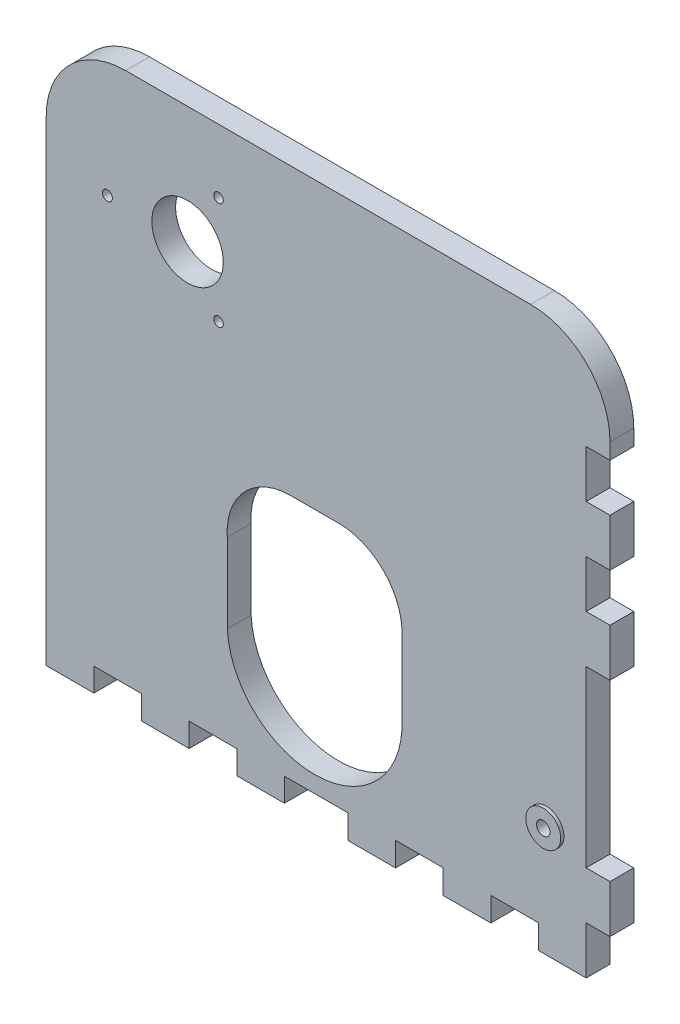
from build123d import *

# Parameters (mm, degrees)
SKETCH1_R           = 11
SKETCH1_R_2         = 3.142556432
SKETCH1_R_3         = 22.5
SKETCH1_R_4         = 3
BOSS_EXTRUDE1_DEPTH = 15
BOSS_EXTRUDE2_START = 10
SKETCH3_R           = 11
SKETCH3_R_2         = 4.25
BOSS_EXTRUDE2_DEPTH = 10


with BuildPart() as part:
    # Sketch1 → Boss-Extrude1 (new body)
    with BuildSketch(Plane.XY):
        with BuildLine():
            Line((-120, 172.705707432), (135, 172.705707432))
            ThreePointArc((135, 172.705707432), (170.355339059, 158.061046491), (185, 122.705707432))
            Line((185, 122.705707432), (185, 112.705707432))
            Line((185, 112.705707432), (170, 112.705707432))
            Line((170, 112.705707432), (170, 82.705707432))
            Line((170, 82.705707432), (185, 82.705707432))
            Line((185, 82.705707432), (185, 52.705707432))
            Line((185, 52.705707432), (170, 52.705707432))
            Line((170, 52.705707432), (170, 22.705707432))
            Line((170, 22.705707432), (185, 22.705707432))
            Line((185, 22.705707432), (185, -7.294292568))
            Line((185, -7.294292568), (170, -7.294292568))
            Line((170, -7.294292568), (170, -117.094321696))
            Line((170, -117.094321696), (185, -117.094321696))
            Line((185, -117.094321696), (185, -147.094321696))
            Line((185, -147.094321696), (170, -147.094321696))
            Line((170, -147.094321696), (170, -162.094292568))
            Line((170, -162.094292568), (170, -177.170123414))
            Line((170, -177.170123414), (140, -177.170123414))
            Line((140, -177.170123414), (140, -162.094292568))
            Line((140, -162.094292568), (110, -162.094292568))
            Line((110, -162.094292568), (110, -177.182197899))
            Line((110, -177.182197899), (80, -177.182197899))
            Line((80, -177.182197899), (80, -162.094292568))
            Line((80, -162.094292568), (50, -162.094292568))
            Line((50, -162.094292568), (50, -177.165057848))
            Line((50, -177.165057848), (20, -177.165057848))
            Line((20, -177.165057848), (20, -162.094292568))
            Line((20, -162.094292568), (-20, -162.094292568))
            Line((-20, -162.094292568), (-20, -176.865618337))
            Line((-20, -176.865618337), (-50, -176.865618337))
            Line((-50, -176.865618337), (-50, -162.094292568))
            Line((-50, -162.094292568), (-80, -162.094292568))
            Line((-80, -162.094292568), (-80, -177.034188853))
            Line((-80, -177.034188853), (-110, -177.034188853))
            Line((-110, -177.034188853), (-110, -162.094292568))
            Line((-110, -162.094292568), (-140, -162.094292568))
            Line((-140, -162.094292568), (-140, -176.801614054))
            Line((-140, -176.801614054), (-170, -176.801614054))
            Line((-170, -176.801614054), (-170, -167.294292568))
            Line((-170, -167.294292568), (-170, 122.705707432))
            ThreePointArc((-170, 122.705707432), (-155.355339059, 158.061046491), (-120, 172.705707432))
        make_face()
        with Locations((145, -107)):
            Circle(SKETCH1_R, mode=Mode.SUBTRACT)
        with Locations((-131.5, 98.85)):
            Circle(SKETCH1_R_2, mode=Mode.SUBTRACT)
        with Locations((-81, 98.85)):
            Circle(SKETCH1_R_3, mode=Mode.SUBTRACT)
        with Locations((-61.5, 65.075009252)):
            Circle(SKETCH1_R_4, mode=Mode.SUBTRACT)
        with Locations((-61.5, 132.624990748)):
            Circle(SKETCH1_R_4, mode=Mode.SUBTRACT)
        with BuildLine():
            Line((-55.995398281, -49.8), (-55.995398281, -99.8))
            ThreePointArc((-55.995398281, -99.8), (-0.995398281, -151.720675316), (54.004601719, -99.8))
            Line((54.004601719, -99.8), (54.004601719, -49.8))
            ThreePointArc((54.004601719, -49.8), (43.536944591, -20.017496175), (14.731892041, -7.100905005))
            Line((14.731892041, -7.100905005), (-16.722688603, -7.100905005))
            ThreePointArc((-16.722688603, -7.100905005), (-45.527741152, -20.017496175), (-55.995398281, -49.8))
        make_face(mode=Mode.SUBTRACT)
    extrude(amount=BOSS_EXTRUDE1_DEPTH)

    # Sketch3 → Boss-Extrude2 (add)
    with BuildSketch(Plane(origin=(0, 0, 17), x_dir=(-1, 0, 0), z_dir=(0, 0, -1)).offset(BOSS_EXTRUDE2_START)):
        with Locations((-145, -107)):
            Circle(SKETCH3_R)
        with Locations((-145, -107)):
            Circle(SKETCH3_R_2, mode=Mode.SUBTRACT)
    extrude(amount=-BOSS_EXTRUDE2_DEPTH)


solid = part.part
